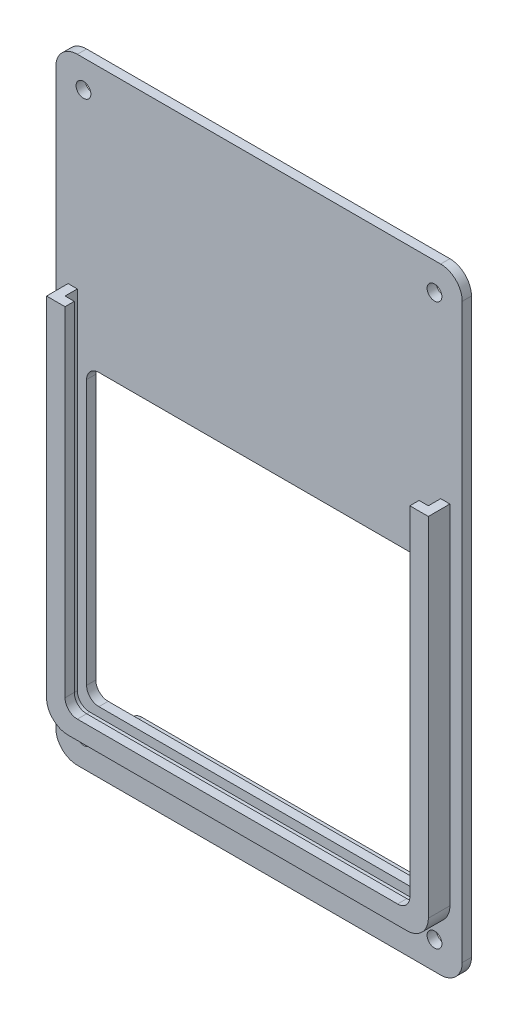
from build123d import *

# Parameters (mm, degrees)
SKETCH_1_W          = 66
SKETCH_1_H          = 100
EXTRUDE_1_DEPTH     = 1.5
FILLET_1_R          = 3.5
SKETCH_2_W          = 56
SKETCH_2_H          = 47
CUT_EXTRUDE_1_DEPTH = 1.5
FILLET_2_R          = 2
EXTRUDE_2_DEPTH     = 2
FILLET_3_R          = 2
EXTRUDE_START       = 1.5
EXTRUDE_3_DEPTH     = 1.5
FILLET_4_R          = 2
FILLET_5_R          = 3.5
SKETCH_5_W          = 48
SKETCH_5_H          = 7.5
EXTRUDE_4_DEPTH     = 1.5
FILLET_6_R          = 2
HOLE_WIZARD_M21_D   = 2.4


with BuildPart() as part:
    # Эскиз1 → Бобышка-Вытянуть1 (new body)
    with BuildSketch(Plane.XY):
        Rectangle(SKETCH_1_W, SKETCH_1_H)
    extrude(amount=EXTRUDE_1_DEPTH)

    # Скругление1
    fillet_1_edges = [part.edges().sort_by_distance(p)[0] for p in [
        (-33, -50, 0.75),
        (-33, 50, 0.75),
        (33, 50, 0.75),
        (33, -50, 0.75),
    ]]
    fillet(fillet_1_edges, radius=FILLET_1_R)

    # Эскиз2 → Вырез-Вытянуть1 (cut)
    with BuildSketch(Plane.XY.offset(1.5)):
        with Locations((0, -16.5)):
            Rectangle(SKETCH_2_W, SKETCH_2_H)
    extrude(amount=-CUT_EXTRUDE_1_DEPTH, mode=Mode.SUBTRACT)

    # Скругление2
    fillet_2_edges = [part.edges().sort_by_distance(p)[0] for p in [
        (28, 7, 0.75),
        (28, -40, 0.75),
        (-28, -40, 0.75),
        (-28, 7, 0.75),
    ]]
    fillet(fillet_2_edges, radius=FILLET_2_R)

    # Эскиз3 → Бобышка-Вытянуть2 (add)
    with BuildSketch(Plane.XY.offset(1.5)):
        Polygon((29.5, -41.5), (-29.5, -41.5), (-29.5, 17), (-31, 17), (-31, -43), (31, -43), (31, 17), (29.5, 17), align=None)
    extrude(amount=EXTRUDE_2_DEPTH)

    # Скругление3
    fillet_3_edges = [part.edges().sort_by_distance(p)[0] for p in [
        (29.5, -41.5, 2.5),
        (-29.5, -41.5, 2.5),
    ]]
    fillet(fillet_3_edges, radius=FILLET_3_R)

    # Эскиз4 → Бобышка-Вытянуть3 (add)
    with BuildSketch(Plane.XY.offset(3.5).offset(EXTRUDE_START)):
        with BuildLine():
            Line((-31, -43), (31, -43))
            Line((31, -43), (31, 17))
            Line((31, 17), (29.5, 17))
            Line((29.5, 17), (29.5, -39.5))
            ThreePointArc((29.5, -39.5), (28.914213562, -40.914213562), (27.5, -41.5))
            Line((27.5, -41.5), (-27.5, -41.5))
            ThreePointArc((-27.5, -41.5), (-28.914213562, -40.914213562), (-29.5, -39.5))
            Line((-29.5, -39.5), (-29.5, 17))
            Line((-29.5, 17), (-31, 17))
            Line((-31, 17), (-31, -43))
        make_face()
        with BuildLine():
            Line((-28, 17), (-29.5, 17))
            Line((-29.5, 17), (-29.5, -39.5))
            ThreePointArc((-29.5, -39.5), (-28.914213562, -40.914213562), (-27.5, -41.5))
            Line((-27.5, -41.5), (27.5, -41.5))
            ThreePointArc((27.5, -41.5), (28.914213562, -40.914213562), (29.5, -39.5))
            Line((29.5, -39.5), (29.5, 17))
            Line((29.5, 17), (28, 17))
            Line((28, 17), (28, -40))
            Line((28, -40), (-28, -40))
            Line((-28, -40), (-28, 17))
        make_face()
    extrude(amount=-EXTRUDE_3_DEPTH)

    # Скругление4
    fillet_4_edges = [part.edges().sort_by_distance(p)[0] for p in [
        (28, -40, 4.25),
        (-28, -40, 4.25),
    ]]
    fillet(fillet_4_edges, radius=FILLET_4_R)

    # Скругление5
    fillet_5_edges = [part.edges().sort_by_distance(p)[0] for p in [
        (31, -43, 3.25),
        (-31, -43, 3.25),
    ]]
    fillet(fillet_5_edges, radius=FILLET_5_R)

    # Эскиз5 → Бобышка-Вытянуть4 (add)
    with BuildSketch(Plane(origin=(0, 0, 0), x_dir=(-1, 0, 0), z_dir=(0, 0, -1))):
        Polygon((24, 48.5), (-24, 48.5), (-24, 41), (-31.5, 41), (-31.5, 8), (31.5, 8), (31.5, 41), (24, 41), align=None)
        with Locations((0, -44.75)):
            Rectangle(SKETCH_5_W, SKETCH_5_H)
    extrude(amount=EXTRUDE_4_DEPTH)

    # Скругление6
    fillet_6_edges = [part.edges().sort_by_distance(p)[0] for p in [
        (-24, 48.5, -0.75),
        (24, 48.5, -0.75),
        (24, 41, -0.75),
        (31.5, 41, -0.75),
        (31.5, 8, -0.75),
        (-31.5, 8, -0.75),
        (-31.5, 41, -0.75),
        (-24, 41, -0.75),
        (-24, -48.5, -0.75),
        (-24, -41, -0.75),
        (24, -41, -0.75),
        (24, -48.5, -0.75),
    ]]
    fillet(fillet_6_edges, radius=FILLET_6_R)

    # Отверстие с зазором M21 (through all)
    with Locations(Plane.XY.offset(1.5)):
        with Locations((-28.5, 45.5), (28.5, 45.5), (28.5, -45.5), (-28.5, -45.5)):
            Hole(HOLE_WIZARD_M21_D / 2)


solid = part.part
